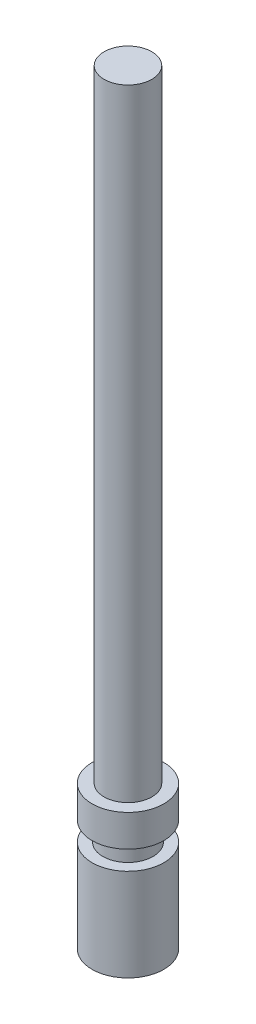
from build123d import *

# Parameters (mm, degrees)
SKETCH_1_R          = 4.5
EXTRUDE_1_DEPTH     = 18
SKETCH_2_R          = 3
EXTRUDE_2_DEPTH     = 96
CUT_EXTRUDE_START   = 11.6
SKETCH_3_OUTSIDE_W  = 30.368
SKETCH_3_OUTSIDE_H  = 30.368
SKETCH_3_OUTSIDE_R  = 3.15
CUT_EXTRUDE_1_DEPTH = 2.4


with BuildPart() as part:
    # 草图1 → 凸台-拉伸1 (new body)
    with BuildSketch(Plane(origin=(0, 0, 0), x_dir=(1, 0, 0), z_dir=(0, 1, 0))):
        with Locations(Location((0, 0, 0), (0, 0, 270))):
            Circle(SKETCH_1_R)
    extrude(amount=EXTRUDE_1_DEPTH)

    # 草图2 → 凸台-拉伸2 (add)
    with BuildSketch(Plane(origin=(0, 0, 0), x_dir=(1, 0, 0), z_dir=(0, 1, 0))):
        with Locations(Location((0, 0, 0), (0, 0, 270))):
            Circle(SKETCH_2_R)
    extrude(amount=EXTRUDE_2_DEPTH)

    # 草图3 outside → 切除-拉伸1 (cut)
    with BuildSketch(Plane(origin=(0, 0, 0), x_dir=(1, 0, 0), z_dir=(0, 1, 0)).offset(CUT_EXTRUDE_START)):
        Rectangle(SKETCH_3_OUTSIDE_W, SKETCH_3_OUTSIDE_H)
        with Locations(Location((0, 0, 0), (0, 0, 270))):
            Circle(SKETCH_3_OUTSIDE_R, mode=Mode.SUBTRACT)
    extrude(amount=CUT_EXTRUDE_1_DEPTH, mode=Mode.SUBTRACT)


solid = part.part
